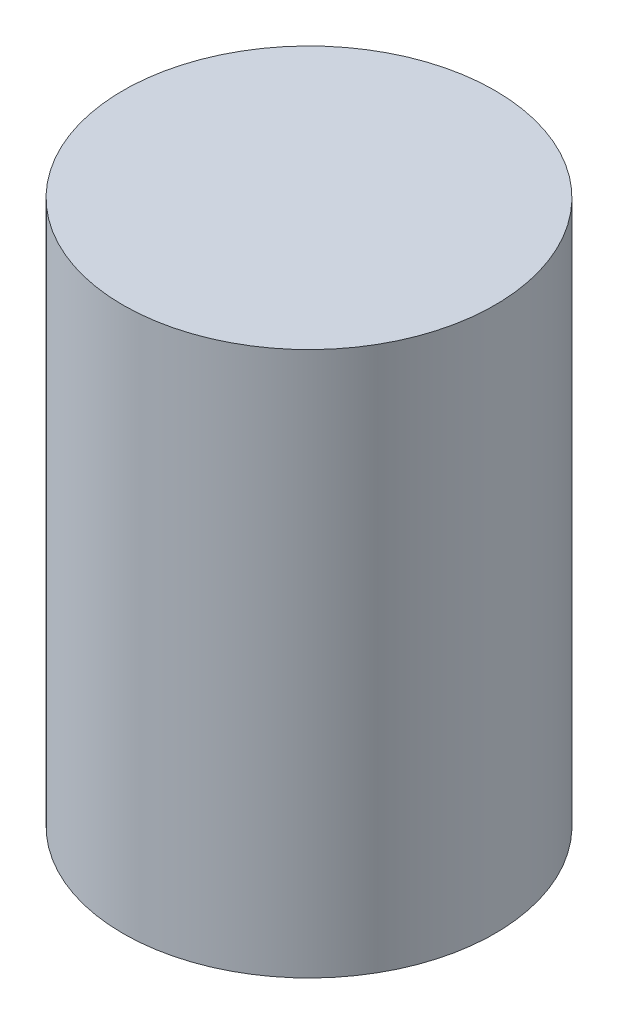
from build123d import *

# Parameters (mm, degrees)
SKETCH1_R           = 20.5
BOSS_EXTRUDE1_DEPTH = 60


with BuildPart() as part:
    # Sketch1 → Boss-Extrude1 (new body)
    with BuildSketch(Plane(origin=(0, 0, 0), x_dir=(1, 0, 0), z_dir=(0, 1, 0))):
        with Locations(Location((0, 0, 0), (0, 0, 270))):
            Circle(SKETCH1_R)
    extrude(amount=BOSS_EXTRUDE1_DEPTH)


solid = part.part
